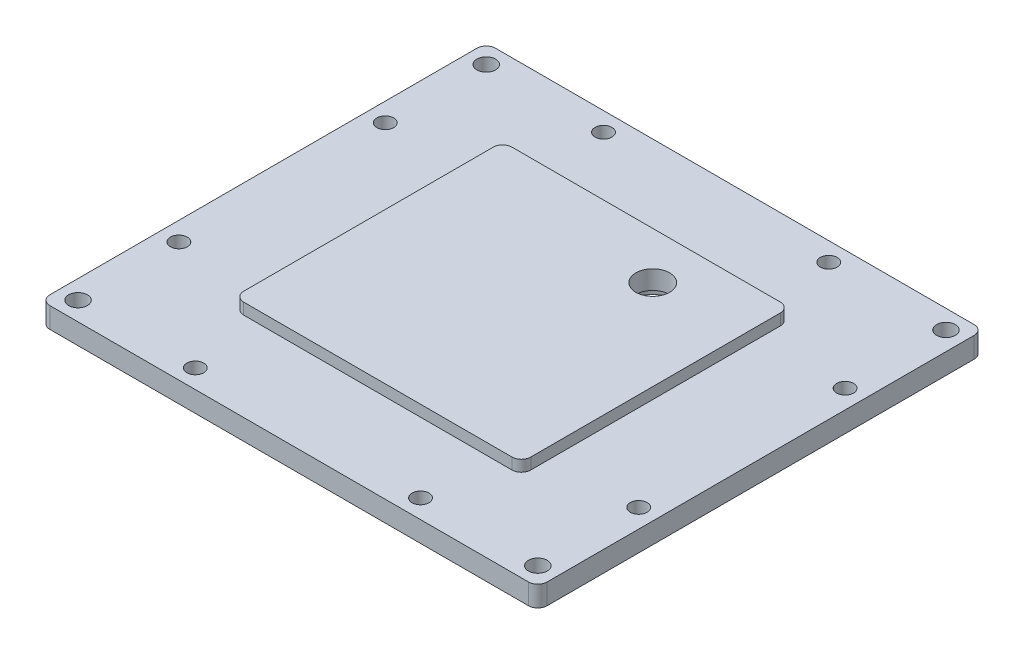
from build123d import *

# Parameters (mm, degrees)
SKETCH1_W           = 530
SKETCH1_H           = 475
BOSS_EXTRUDE1_DEPTH = 11
SKETCH2_W           = 306
SKETCH2_H           = 286
BOSS_EXTRUDE2_DEPTH = 12
SKETCH3_R           = 10
SKETCH3_R_2         = 9
CUT_EXTRUDE1_DEPTH  = 357.532256605
SKETCH4_R           = 18
CUT_EXTRUDE2_DEPTH  = 358.473425586
SKETCH5_R           = 32.5
CUT_EXTRUDE3_DEPTH  = 14
FILLET1_R           = 10


with BuildPart() as part:
    # Sketch1 → Boss-Extrude1 (new, symmetric)
    with BuildSketch(Plane(origin=(0, 0, 0), x_dir=(1, 0, 0), z_dir=(0, 1, 0))):
        Rectangle(SKETCH1_W, SKETCH1_H)
    extrude(amount=BOSS_EXTRUDE1_DEPTH, both=True)

    # Sketch2 → Boss-Extrude2 (add)
    with BuildSketch(Plane(origin=(0, 11, 0), x_dir=(1, 0, 0), z_dir=(0, 1, 0))):
        Rectangle(SKETCH2_W, SKETCH2_H)
    extrude(amount=BOSS_EXTRUDE2_DEPTH)

    # Sketch3 → Cut-Extrude1 (cut, through all)
    with BuildSketch(Plane(origin=(0, 11, 0), x_dir=(1, 0, 0), z_dir=(0, 1, 0))):
        with Locations(Location((-245, 217.5, 0), (0, 0, 270))):
            Circle(SKETCH3_R)
        with Locations(Location((-120, 217.5, 0), (0, 0, 270))):
            Circle(SKETCH3_R_2)
        with Locations(Location((-245, 110, 0), (0, 0, 270))):
            Circle(SKETCH3_R_2)
        with Locations(Location((120, 217.5, 0), (0, 0, 90))):
            Circle(SKETCH3_R_2)
        with Locations(Location((245, 217.5, 0), (0, 0, 90))):
            Circle(SKETCH3_R)
        with Locations(Location((245, 110, 0), (0, 0, 90))):
            Circle(SKETCH3_R_2)
        with Locations(Location((245, -110, 0), (0, 0, 270))):
            Circle(SKETCH3_R_2)
        with Locations(Location((245, -217.5, 0), (0, 0, 270))):
            Circle(SKETCH3_R)
        with Locations(Location((120, -217.5, 0), (0, 0, 270))):
            Circle(SKETCH3_R_2)
        with Locations(Location((-120, -217.5, 0), (0, 0, 90))):
            Circle(SKETCH3_R_2)
        with Locations(Location((-245, -110, 0), (0, 0, 90))):
            Circle(SKETCH3_R_2)
        with Locations(Location((-245, -217.5, 0), (0, 0, 90))):
            Circle(SKETCH3_R)
    extrude(amount=-CUT_EXTRUDE1_DEPTH, mode=Mode.SUBTRACT)

    # Sketch4 → Cut-Extrude2 (cut, through all)
    with BuildSketch(Plane(origin=(0, 23, 0), x_dir=(1, 0, 0), z_dir=(0, 1, 0))):
        with Locations(Location((57, 93, 0), (0, 0, 270))):
            Circle(SKETCH4_R)
    extrude(amount=-CUT_EXTRUDE2_DEPTH, mode=Mode.SUBTRACT)

    # Sketch5 → Cut-Extrude3 (cut)
    with BuildSketch(Plane.XZ.offset(11)):
        with Locations(Location((57, -93, 0), (0, 0, 270))):
            Circle(SKETCH5_R)
    extrude(amount=-CUT_EXTRUDE3_DEPTH, mode=Mode.SUBTRACT)

    # Fillet1
    fillet1_edges = [part.edges().sort_by_distance(p)[0] for p in [
        (153, 17, 143),
        (153, 17, -143),
        (-153, 17, -143),
        (-153, 17, 143),
        (265, 0, 237.5),
        (-265, 0, 237.5),
        (-265, 0, -237.5),
        (265, 0, -237.5),
    ]]
    fillet(fillet1_edges, radius=FILLET1_R)


solid = part.part
